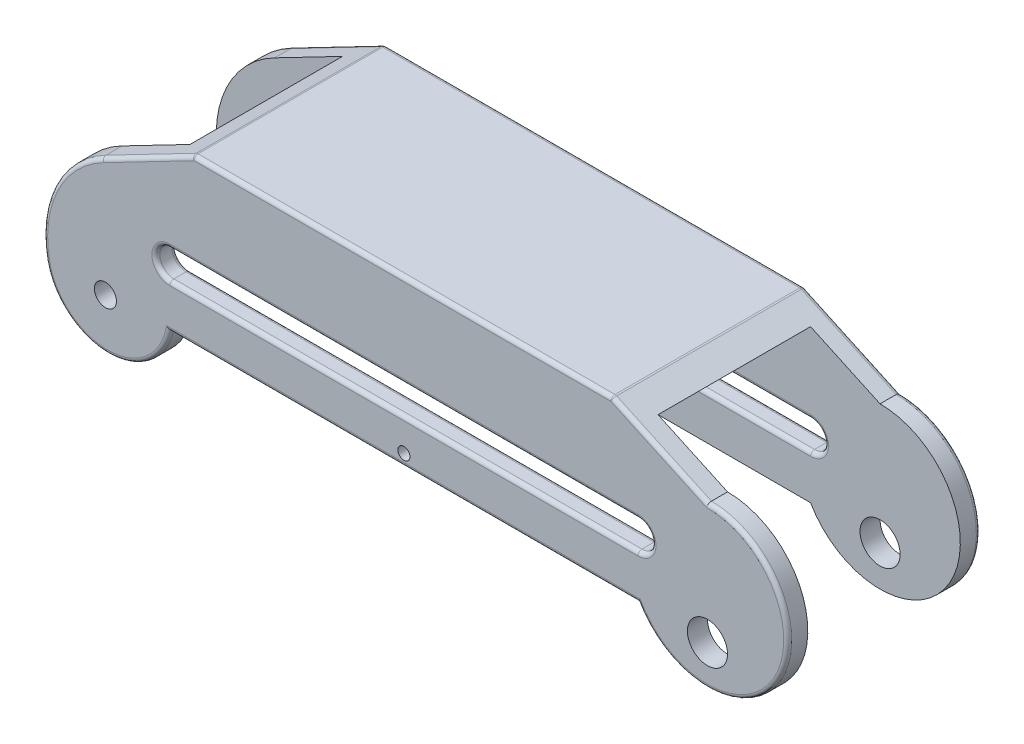
from build123d import *

# Parameters (mm, degrees)
SKETCH1_R              = 5.5
SKETCH1_R_2            = 1.5
SKETCH1_R_3            = 5
BOSS_EXTRUDE1_DEPTH    = 5
SKETCH2_R              = 2.75
SKETCH2_R_2            = 5
SKETCH2_R_3            = 1.5
BOSS_EXTRUDE2_DEPTH    = 5
BOSS_EXTRUDE4_START    = -48
BOSS_EXTRUDE4_DEPTH    = 48
FILLET1_R              = 1
BOSS_EXTRUDE5_START    = -16
BOSS_EXTRUDE5_DEPTH    = 3
FILLET2_R              = 2
LPATTERN1_COUNT        = 3
LPATTERN1_PITCH        = 40
FILLET2_OF_LPATTERN1_R = 2


with BuildPart() as part:
    # Sketch1 → Boss-Extrude1 (new body)
    with BuildSketch(Plane.XY):
        with BuildLine():
            Line((-58.308676511, -15), (58.308676511, -15))
            ThreePointArc((58.308676511, -15), (92.949692663, -15), (75.629184587, 15))
            Line((75.629184587, 15), (58.308676511, 22.996128985))
            Line((58.308676511, 22.996128985), (-58.308676511, 22.996128985))
            Line((-58.308676511, 22.996128985), (-75.243665272, 14.212949924))
            ThreePointArc((-75.243665272, 14.212949924), (-87.141316573, 1.955509585), (-89.217284989, -15))
            ThreePointArc((-89.217284989, -15), (-73.76298075, -27.603590324), (-58.308676511, -15))
        make_face()
        with Locations((-74.370815413, -15)):
            Circle(SKETCH1_R, mode=Mode.SUBTRACT)
        with Locations(Location((-74.370815413, -7, 0), (0, 0, 180))):
            Circle(SKETCH1_R_2, mode=Mode.SUBTRACT)
        with Locations((75.629184587, -15)):
            Circle(SKETCH1_R_3, mode=Mode.SUBTRACT)
        with Locations((0, -12)):
            Circle(SKETCH1_R_2, mode=Mode.SUBTRACT)
        with Locations(Location((-66.370815413, -15, 0), (0, 0, 180))):
            Circle(SKETCH1_R_2, mode=Mode.SUBTRACT)
        with Locations(Location((-74.370815413, -23, 0), (0, 0, 180))):
            Circle(SKETCH1_R_2, mode=Mode.SUBTRACT)
        with Locations(Location((-82.370815413, -15, 0), (0, 0, 180))):
            Circle(SKETCH1_R_2, mode=Mode.SUBTRACT)
        with BuildLine():
            Line((-58.308676511, -4.003871015), (58.308676511, -4.003871015))
            ThreePointArc((58.308676511, -4.003871015), (61.808676511, -0.503871015), (58.308676511, 2.996128985))
            Line((58.308676511, 2.996128985), (-58.308676511, 2.996128985))
            ThreePointArc((-58.308676511, 2.996128985), (-61.808676511, -0.503871015), (-58.308676511, -4.003871015))
        make_face(mode=Mode.SUBTRACT)
    extrude(amount=BOSS_EXTRUDE1_DEPTH)



with BuildPart() as body_2:
    # Sketch2 → Boss-Extrude2 (new body)
    with BuildSketch(Plane.XY.offset(43)):
        with BuildLine():
            Line((58.308676511, 22.996128985), (-58.308676511, 22.996128985))
            Line((-58.308676511, 22.996128985), (-75.243665272, 14.212949924))
            ThreePointArc((-75.243665272, 14.212949924), (-87.141316573, 1.955509585), (-89.217284989, -15))
            ThreePointArc((-89.217284989, -15), (-73.76298075, -27.603590324), (-58.308676511, -15))
            Line((-58.308676511, -15), (58.308676511, -15))
            ThreePointArc((58.308676511, -15), (92.949692663, -15), (75.629184587, 15))
            Line((75.629184587, 15), (58.308676511, 22.996128985))
        make_face()
        with Locations((-74.370815413, -15)):
            Circle(SKETCH2_R, mode=Mode.SUBTRACT)
        with Locations((75.629184587, -15)):
            Circle(SKETCH2_R_2, mode=Mode.SUBTRACT)
        with Locations((0, -12)):
            Circle(SKETCH2_R_3, mode=Mode.SUBTRACT)
        with BuildLine():
            Line((-58.308676511, -4.003871015), (58.308676511, -4.003871015))
            ThreePointArc((58.308676511, -4.003871015), (61.808676511, -0.503871015), (58.308676511, 2.996128985))
            Line((58.308676511, 2.996128985), (-58.308676511, 2.996128985))
            ThreePointArc((-58.308676511, 2.996128985), (-61.808676511, -0.503871015), (-58.308676511, -4.003871015))
        make_face(mode=Mode.SUBTRACT)
    extrude(amount=BOSS_EXTRUDE2_DEPTH)


with BuildPart() as part_1:
    add(part.part)

    add(body_2.part)  # Boss-Extrude4 merges body 2
    # Sketch5 → Boss-Extrude4 (add)
    with BuildSketch(Plane.XY.offset(48).offset(BOSS_EXTRUDE4_START)):
        Polygon((-58.308676511, 22.996128985), (-52.524328279, 25.996128985), (51.810341589, 25.996128985), (58.308676511, 22.996128985), align=None)
    extrude(amount=BOSS_EXTRUDE4_DEPTH)

    # Fillet1
    fillet1_edges = [part_1.edges().sort_by_distance(p)[0] for p in [
        (-73.76298075, -27.603590324, 0),
        (-61.808676511, -0.503871015, 0),
        (0, -4.003871015, 0),
        (61.808676511, -0.503871015, 0),
        (0, 2.996128985, 0),
        (-61.808676511, -0.503871015, 5),
        (0, -4.003871015, 5),
        (61.808676511, -0.503871015, 5),
        (0, 2.996128985, 5),
        (-0.356993345, 25.996128985, 0),
        (-52.524328279, 25.996128985, 24),
        (51.810341589, 25.996128985, 24),
        (63.719763088, 20.498064493, 48),
        (-0.356993345, 25.996128985, 48),
        (-63.883996775, 20.104539454, 48),
        (-87.141316573, 1.955509585, 0),
        (-73.76298075, -27.603590324, 48),
        (0, -15, 48),
        (92.949692663, -15, 48),
        (-87.141316573, 1.955509585, 48),
        (61.808676511, -0.503871015, 43),
        (0, 2.996128985, 43),
        (-61.808676511, -0.503871015, 43),
        (0, -4.003871015, 43),
        (-63.883996775, 20.104539454, 0),
        (61.808676511, -0.503871015, 48),
        (0, 2.996128985, 48),
        (-61.808676511, -0.503871015, 48),
        (0, -4.003871015, 48),
        (63.719763088, 20.498064493, 0),
        (92.949692663, -15, 0),
        (0, -15, 0),
    ]]
    fillet(fillet1_edges, radius=FILLET1_R)

    # Sketch7 → Boss-Extrude5 (add)
    with BuildSketch(Plane(origin=(58.308676511, 0, 0), x_dir=(0, 0, -1), z_dir=(1, 0, 0)).offset(BOSS_EXTRUDE5_START)):
        Polygon((-5, 14.996128985), (-15, 14.996128985), (-15, 22.996128985), (-18, 22.996128985), (-18, 11.996128985), (-5, 11.996128985), align=None)
    boss_extrude5 = extrude(amount=-BOSS_EXTRUDE5_DEPTH)

    # Fillet2
    fillet2_edges = [part_1.edges().sort_by_distance(p)[0] for p in [
        (40.808676511, 11.996128985, 18),
        (40.808676511, 14.996128985, 15),
    ]]
    fillet(fillet2_edges, radius=FILLET2_R)

    # LPattern1: Boss-Extrude5 ×3
    with Locations(*[(-i * LPATTERN1_PITCH, 0, 0) for i in range(1, LPATTERN1_COUNT)]):
        add(boss_extrude5)

    # Fillet2 of LPattern1
    fillet2_of_lpattern1_edges = [part_1.edges().sort_by_distance(p)[0] for p in [
        (0.808676511, 11.996128985, 18),
        (0.808676511, 14.996128985, 15),
        (-39.191323489, 11.996128985, 18),
        (-39.191323489, 14.996128985, 15),
    ]]
    fillet(fillet2_of_lpattern1_edges, radius=FILLET2_OF_LPATTERN1_R)


solid = part_1.part
